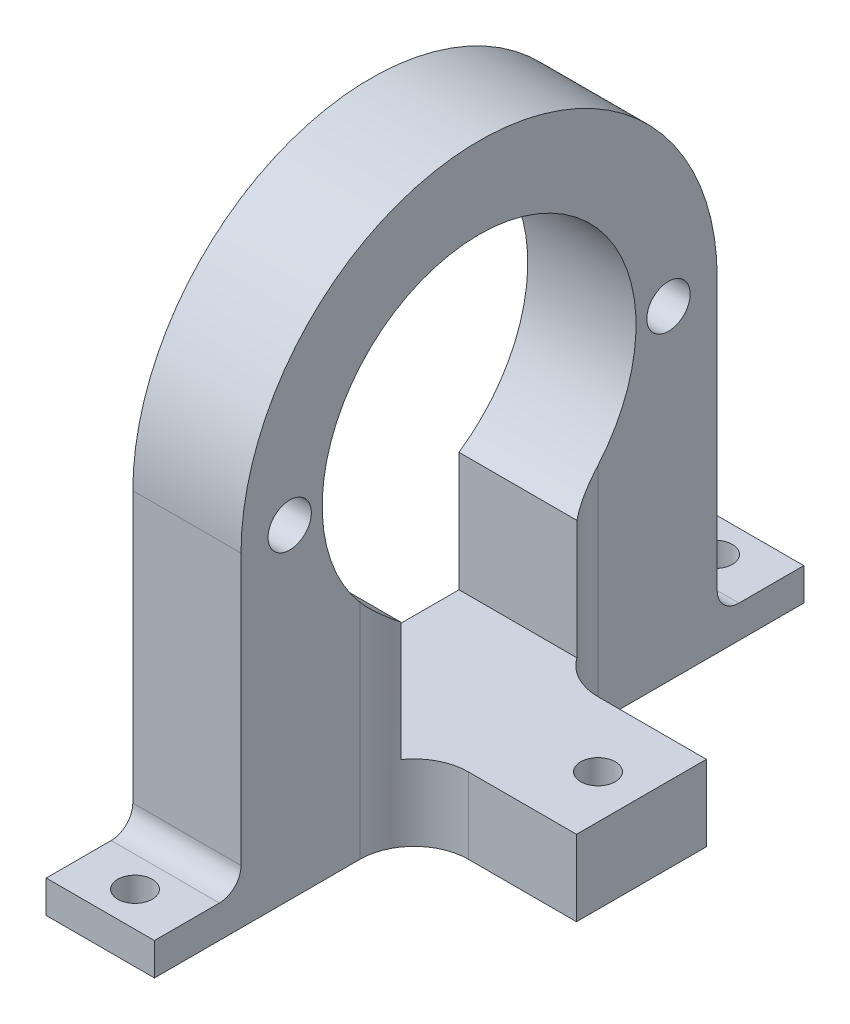
from build123d import *

# Parameters (mm, degrees)
BOSS_EXTRUDE1_DEPTH     = 5
CUT_EXTRUDE1_DEPTH      = 48.542086618
SKETCH3_R               = 2
CUT_EXTRUDE2_DEPTH      = 48.542086618
FILLET1_R               = 2
SKETCH5_W               = 12
SKETCH5_H               = 7
BOSS_EXTRUDE2_DEPTH     = 15
CUT_EXTRUDE3_DEPTH      = 61.835844697
CUT_EXTRUDE3_DEPTH_BACK = 61.835844697
SKETCH4_R               = 1.6
FILLET2_R               = 5


with BuildPart() as part:
    # Sketch1 → Boss-Extrude1 (new, symmetric)
    with BuildSketch(Plane(origin=(0, 0, 0), x_dir=(0, 0, -1), z_dir=(1, 0, 0))):
        with BuildLine():
            Line((22, -13.5), (30, -13.5))
            Line((30, -13.5), (30, -16.5))
            Line((30, -16.5), (-30, -16.5))
            Line((-30, -16.5), (-30, -13.5))
            Line((-30, -13.5), (-22, -13.5))
            Line((-22, -13.5), (-22, 13.5))
            ThreePointArc((-22, 13.5), (0, 35.5), (22, 13.5))
            Line((22, 13.5), (22, -13.5))
        make_face()
    extrude(amount=BOSS_EXTRUDE1_DEPTH, both=True)

    # Sketch2 → Cut-Extrude1 (cut, through all)
    with BuildSketch(Plane(origin=(5, 0, 0), x_dir=(0, 0, -1), z_dir=(1, 0, 0))):
        with BuildLine():
            Line((-8.139410298, 1.5), (-8.139410298, -9.5))
            Line((-8.139410298, -9.5), (8.139410298, -9.5))
            Line((8.139410298, -9.5), (8.139410298, 1.5))
            ThreePointArc((8.139410298, 1.5), (0, 28), (-8.139410298, 1.5))
        make_face()
    extrude(amount=-CUT_EXTRUDE1_DEPTH, mode=Mode.SUBTRACT)

    # Sketch3 → Cut-Extrude2 (cut, through all)
    with BuildSketch(Plane.ZY.offset(5)):
        with Locations((17.5, 13.5)):
            Circle(SKETCH3_R)
        with Locations((-17.5, 13.5)):
            Circle(SKETCH3_R)
    extrude(amount=-CUT_EXTRUDE2_DEPTH, mode=Mode.SUBTRACT)

    # Fillet1
    fillet1_edges = [part.edges().sort_by_distance(p)[0] for p in [
        (0, -13.5, -22),
        (0, -13.5, 22),
    ]]
    fillet(fillet1_edges, radius=FILLET1_R)

    # Sketch5 → Boss-Extrude2 (add)
    with BuildSketch(Plane(origin=(5, 0, 0), x_dir=(0, 0, -1), z_dir=(1, 0, 0))):
        with Locations((0, -13)):
            Rectangle(SKETCH5_W, SKETCH5_H)
    extrude(amount=BOSS_EXTRUDE2_DEPTH)

    # Sketch4 → Cut-Extrude3 (cut, two sides: drawn at the far end of the back side and taken through both)
    with BuildSketch(Plane(origin=(0, -13.5, 0), x_dir=(1, 0, 0), z_dir=(0, 1, 0)).offset(-CUT_EXTRUDE3_DEPTH_BACK)):
        with Locations(Location((0, 26.8, 0), (0, 0, 270))):
            Circle(SKETCH4_R)
        with Locations(Location((0, -26.8, 0), (0, 0, 270))):
            Circle(SKETCH4_R)
        with Locations(Location((15.988182788, 0, 0), (0, 0, 270))):
            Circle(SKETCH4_R)
    extrude(amount=CUT_EXTRUDE3_DEPTH + CUT_EXTRUDE3_DEPTH_BACK, mode=Mode.SUBTRACT)

    # Fillet2
    fillet2_edges = [part.edges().sort_by_distance(p)[0] for p in [
        (5, -13, -6),
        (5, -13, 6),
    ]]
    fillet(fillet2_edges, radius=FILLET2_R)


solid = part.part
